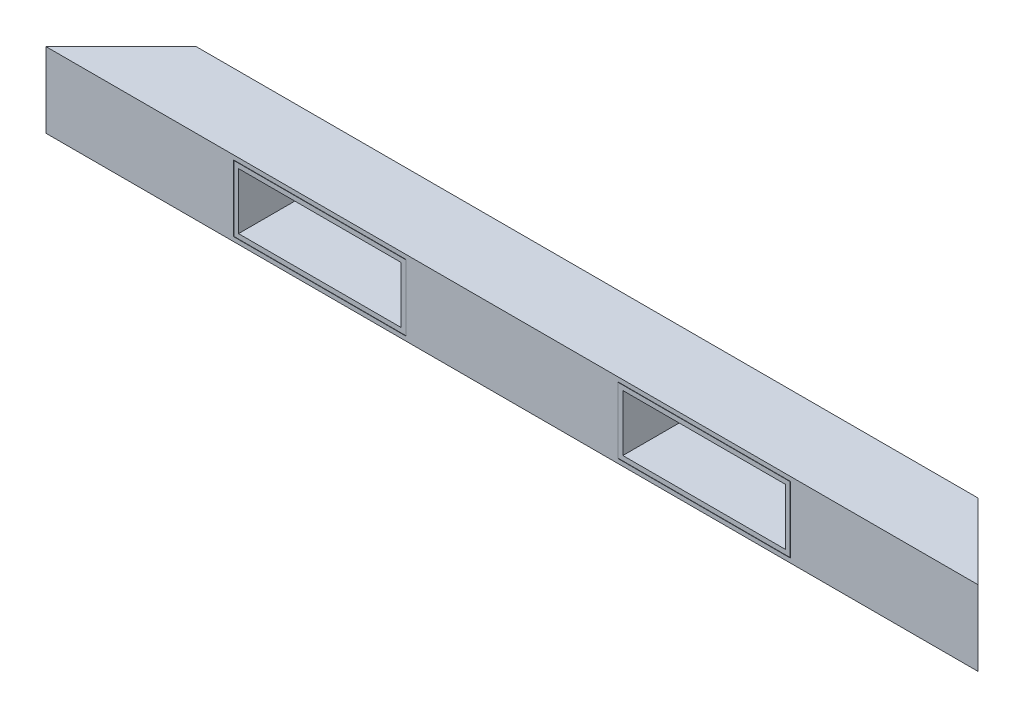
from build123d import *

# Parameters (mm, degrees)
CROQUIS1_W              = 1260.95
CROQUIS1_H              = 101.6
SALIENTE_EXTRUIR1_DEPTH = 101.6
CROQUIS5_W              = 88.9
CROQUIS5_H              = 88.9
CORTAR_EXTRUIR4_DEPTH   = 1260.95
CORTAR_EXTRUIR5_DEPTH   = 101.6
CORTAR_EXTRUIR6_REACH   = 1271.11
CROQUIS7_W              = 220
CROQUIS7_H              = 76.2
CROQUIS8_W              = 232.7
CROQUIS8_H              = 88.9
CROQUIS8_W_2            = 220
CROQUIS8_H_2            = 76.2
SALIENTE_EXTRUIR2_DEPTH = 101.6
CORTAR_EXTRUIR7_REACH   = 1271.11
CROQUIS9_W              = 233.7
CROQUIS9_H              = 89.9
CROQUIS9_W_2            = 232.7
CROQUIS9_H_2            = 88.9


with BuildPart() as part:
    # Croquis1 → Saliente-Extruir1 (new body)
    with BuildSketch(Plane.XY):
        with Locations((630.475, 50.8)):
            Rectangle(CROQUIS1_W, CROQUIS1_H)
    extrude(amount=SALIENTE_EXTRUIR1_DEPTH)

    # Croquis5 → Cortar-Extruir4 (cut)
    with BuildSketch(Plane(origin=(1260.95, 0, 0), x_dir=(0, 0, -1), z_dir=(1, 0, 0))):
        with Locations((-50.8, 50.8)):
            Rectangle(CROQUIS5_W, CROQUIS5_H)
    extrude(amount=-CORTAR_EXTRUIR4_DEPTH, mode=Mode.SUBTRACT)

    # Croquis6 → Cortar-Extruir5 (cut)
    with BuildSketch(Plane(origin=(0, 101.6, 0), x_dir=(1, 0, 0), z_dir=(0, 1, 0))):
        Polygon((0, 0), (101.6, 0), (0, -101.6), align=None)
        Polygon((1260.95, -101.6), (1260.95, 0), (1159.35, 0), align=None)
    extrude(amount=-CORTAR_EXTRUIR5_DEPTH, mode=Mode.SUBTRACT)

    # Cortar-Extruir6: up to this face of the body (flat: up to its plane)
    cortar_extruir6_end = Plane(part.part.faces().sort_by_distance((630.475, 50.8, 0))[0])
    # Croquis7 → Cortar-Extruir6 (cut, up to the picked face)
    with BuildSketch(Plane.XY.offset(101.6), mode=Mode.PRIVATE) as cortar_extruir6_sk1:
        with Locations((370.475, 50.8)):
            Rectangle(CROQUIS7_W, CROQUIS7_H)
    cortar_extruir6_tool1 = split(extrude(cortar_extruir6_sk1.sketch, amount=-CORTAR_EXTRUIR6_REACH, mode=Mode.PRIVATE), bisect_by=cortar_extruir6_end, keep=Keep.BOTH, mode=Mode.PRIVATE)
    # Croquis7 → Cortar-Extruir6 (cut, up to the picked face)
    with BuildSketch(Plane.XY.offset(101.6), mode=Mode.PRIVATE) as cortar_extruir6_sk2:
        with Locations((890.475, 50.8)):
            Rectangle(CROQUIS7_W, CROQUIS7_H)
    cortar_extruir6_tool2 = split(extrude(cortar_extruir6_sk2.sketch, amount=-CORTAR_EXTRUIR6_REACH, mode=Mode.PRIVATE), bisect_by=cortar_extruir6_end, keep=Keep.BOTH, mode=Mode.PRIVATE)
    add(cortar_extruir6_tool1.solids().sort_by(Axis((370.475, 50.8, 101.6), (0, 0, -1)))[0], mode=Mode.SUBTRACT)
    add(cortar_extruir6_tool2.solids().sort_by(Axis((890.475, 50.8, 101.6), (0, 0, -1)))[0], mode=Mode.SUBTRACT)

    # Croquis8 → Saliente-Extruir2 (add)
    # profile 1 of 2: a face of its own
    with BuildSketch(Plane.XY.offset(101.6)):
        with Locations((370.475, 50.8)):
            Rectangle(CROQUIS8_W, CROQUIS8_H)
        with Locations((370.475, 50.8)):
            Rectangle(CROQUIS8_W_2, CROQUIS8_H_2, mode=Mode.SUBTRACT)
    # profile 2 of 2: a face of its own
    with BuildSketch(Plane.XY.offset(101.6)):
        with Locations((890.475, 50.8)):
            Rectangle(CROQUIS8_W, CROQUIS8_H)
        with Locations((890.475, 50.8)):
            Rectangle(CROQUIS8_W_2, CROQUIS8_H_2, mode=Mode.SUBTRACT)
    extrude(amount=-SALIENTE_EXTRUIR2_DEPTH)

    # Cortar-Extruir7: up to this face of the body (flat: up to its plane)
    cortar_extruir7_end = Plane(part.part.faces().sort_by_distance((630.475, 50.8, 0))[0])
    # Croquis9 → Cortar-Extruir7 (cut, up to the picked face)
    with BuildSketch(Plane.XY.offset(101.6), mode=Mode.PRIVATE) as cortar_extruir7_sk1:
        with Locations((370.475, 50.8)):
            Rectangle(CROQUIS9_W, CROQUIS9_H)
        with Locations((370.475, 50.8)):
            Rectangle(CROQUIS9_W_2, CROQUIS9_H_2, mode=Mode.SUBTRACT)
    cortar_extruir7_tool1 = split(extrude(cortar_extruir7_sk1.sketch, amount=-CORTAR_EXTRUIR7_REACH, mode=Mode.PRIVATE), bisect_by=cortar_extruir7_end, keep=Keep.BOTH, mode=Mode.PRIVATE)
    # Croquis9 → Cortar-Extruir7 (cut, up to the picked face)
    with BuildSketch(Plane.XY.offset(101.6), mode=Mode.PRIVATE) as cortar_extruir7_sk2:
        with Locations((890.475, 50.8)):
            Rectangle(CROQUIS9_W, CROQUIS9_H)
        with Locations((890.475, 50.8)):
            Rectangle(CROQUIS9_W_2, CROQUIS9_H_2, mode=Mode.SUBTRACT)
    cortar_extruir7_tool2 = split(extrude(cortar_extruir7_sk2.sketch, amount=-CORTAR_EXTRUIR7_REACH, mode=Mode.PRIVATE), bisect_by=cortar_extruir7_end, keep=Keep.BOTH, mode=Mode.PRIVATE)
    add(cortar_extruir7_tool1.solids().sort_by(Axis((370.475, 6.100395, 101.6), (0, 0, -1)))[0], mode=Mode.SUBTRACT)
    add(cortar_extruir7_tool2.solids().sort_by(Axis((1007.074605, 50.8, 101.6), (0, 0, -1)))[0], mode=Mode.SUBTRACT)


with BuildPart() as cortar_extruir7_piece_1:
    # of the separate pieces the step leaves, piece 1, a body of its own (cortar_extruir7_pieces)
    add(part.part.solids().sort_by_distance((101.6, 0, 0))[0])


with BuildPart() as cortar_extruir7_piece_2:
    # of the separate pieces the step leaves, piece 2, a body of its own (cortar_extruir7_pieces)
    add(part.part.solids().sort_by_distance((486.825, 95.25, 0))[0])


with BuildPart() as cortar_extruir7_piece_3:
    # of the separate pieces the step leaves, piece 3, a body of its own (cortar_extruir7_pieces)
    add(part.part.solids().sort_by_distance((1006.825, 95.25, 0))[0])


solid = Compound([cortar_extruir7_piece_1.part, cortar_extruir7_piece_2.part, cortar_extruir7_piece_3.part])
